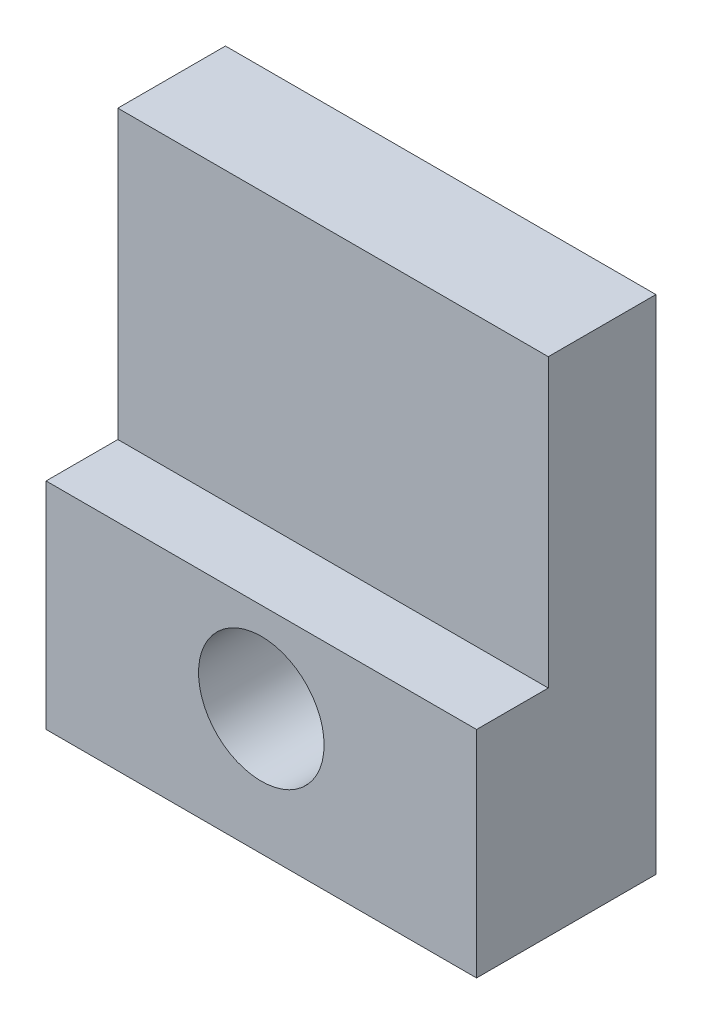
from build123d import *

# Parameters (mm, degrees)
SKETCH_1_W          = 12
SKETCH_1_H          = 14
SKETCH_1_R          = 1.75
EXTRUDE_1_DEPTH     = 5
SKETCH_2_W          = 16.082841594
SKETCH_2_H          = 10
CUT_EXTRUDE_1_DEPTH = 2


with BuildPart() as part:
    # Эскиз1 → Вытянуть1 (new body)
    with BuildSketch(Plane.XY):
        Rectangle(SKETCH_1_W, SKETCH_1_H)
        with Locations((0, -3.5)):
            Circle(SKETCH_1_R, mode=Mode.SUBTRACT)
    extrude(amount=EXTRUDE_1_DEPTH)

    # Эскиз2 → Вырез-Вытянуть1 (cut)
    with BuildSketch(Plane.XY.offset(5)):
        with Locations((-0.230919178, 4)):
            Rectangle(SKETCH_2_W, SKETCH_2_H)
    extrude(amount=-CUT_EXTRUDE_1_DEPTH, mode=Mode.SUBTRACT)


solid = part.part
